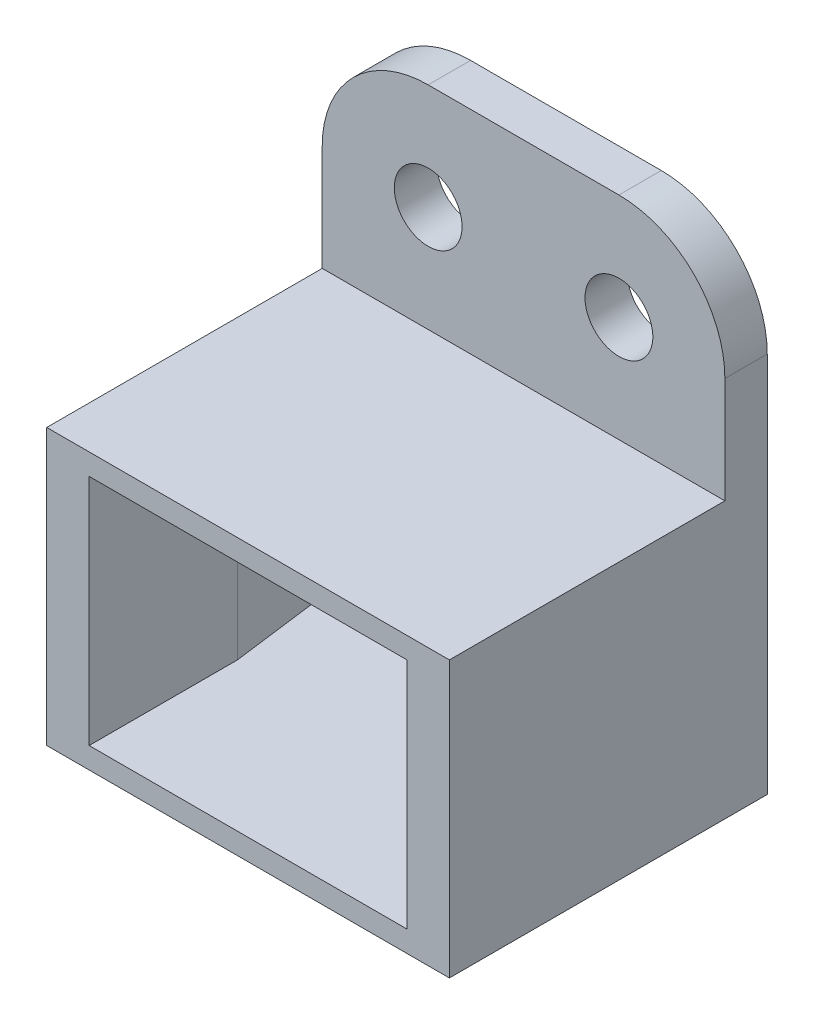
from build123d import *

# Parameters (mm, degrees)
SKETCH1_W           = 38
SKETCH1_H           = 26
SKETCH1_W_2         = 30
SKETCH1_H_2         = 22
BOSS_EXTRUDE1_DEPTH = 30
CUT_EXTRUDE1_DEPTH  = 22
SKETCH3_R           = 3.2
BOSS_EXTRUDE2_DEPTH = 4


with BuildPart() as part:
    # Sketch1 → Boss-Extrude1 (new body)
    with BuildSketch(Plane.XY):
        Rectangle(SKETCH1_W, SKETCH1_H)
        Rectangle(SKETCH1_W_2, SKETCH1_H_2, mode=Mode.SUBTRACT)
    extrude(amount=BOSS_EXTRUDE1_DEPTH)

    # Sketch2 → Cut-Extrude1 (cut)
    with BuildSketch(Plane.XZ.offset(-11)):
        Polygon((15, 0), (16.5, 4.5), (15, 16), align=None)
        Polygon((-15, 16), (-15, 0), (-16.5, 4.5), align=None)
    extrude(amount=CUT_EXTRUDE1_DEPTH, mode=Mode.SUBTRACT)

    # Sketch3 → Boss-Extrude2 (add)
    with BuildSketch(Plane(origin=(0, 0, 0), x_dir=(-1, 0, 0), z_dir=(0, 0, -1))):
        with BuildLine():
            Line((19, 13), (-19, 13))
            Line((-19, 13), (-19, 23))
            ThreePointArc((-19, 23), (-16.071067812, 30.071067812), (-9, 33))
            Line((-9, 33), (9, 33))
            ThreePointArc((9, 33), (16.071067812, 30.071067812), (19, 23))
            Line((19, 23), (19, 13))
        make_face()
        with Locations((-9, 23)):
            Circle(SKETCH3_R, mode=Mode.SUBTRACT)
        with Locations((9, 23)):
            Circle(SKETCH3_R, mode=Mode.SUBTRACT)
    extrude(amount=-BOSS_EXTRUDE2_DEPTH)


solid = part.part
